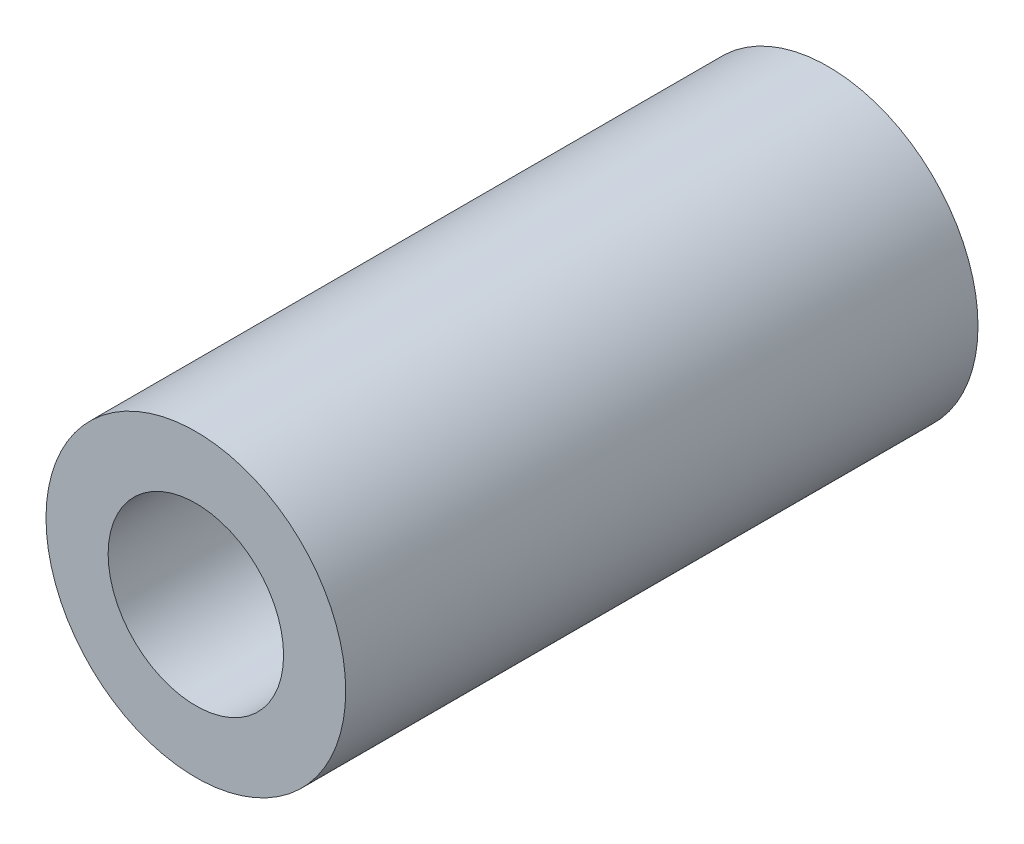
from build123d import *

# Parameters (mm, degrees)
BOSS_EXTRUDE1_DEPTH      = 36
BOSS_EXTRUDE1_DEPTH_BACK = 50.5
SKETCH1_R                = 20.5
SKETCH1_R_2              = 12


with BuildPart() as part:
    # Sketch1 → Boss-Extrude1 (new, two sides: drawn at the far end of the back side and taken through both)
    with BuildSketch(Plane.XY.offset(-BOSS_EXTRUDE1_DEPTH_BACK)):
        Circle(SKETCH1_R)
        Circle(SKETCH1_R_2, mode=Mode.SUBTRACT)
    extrude(amount=BOSS_EXTRUDE1_DEPTH + BOSS_EXTRUDE1_DEPTH_BACK)


solid = part.part
